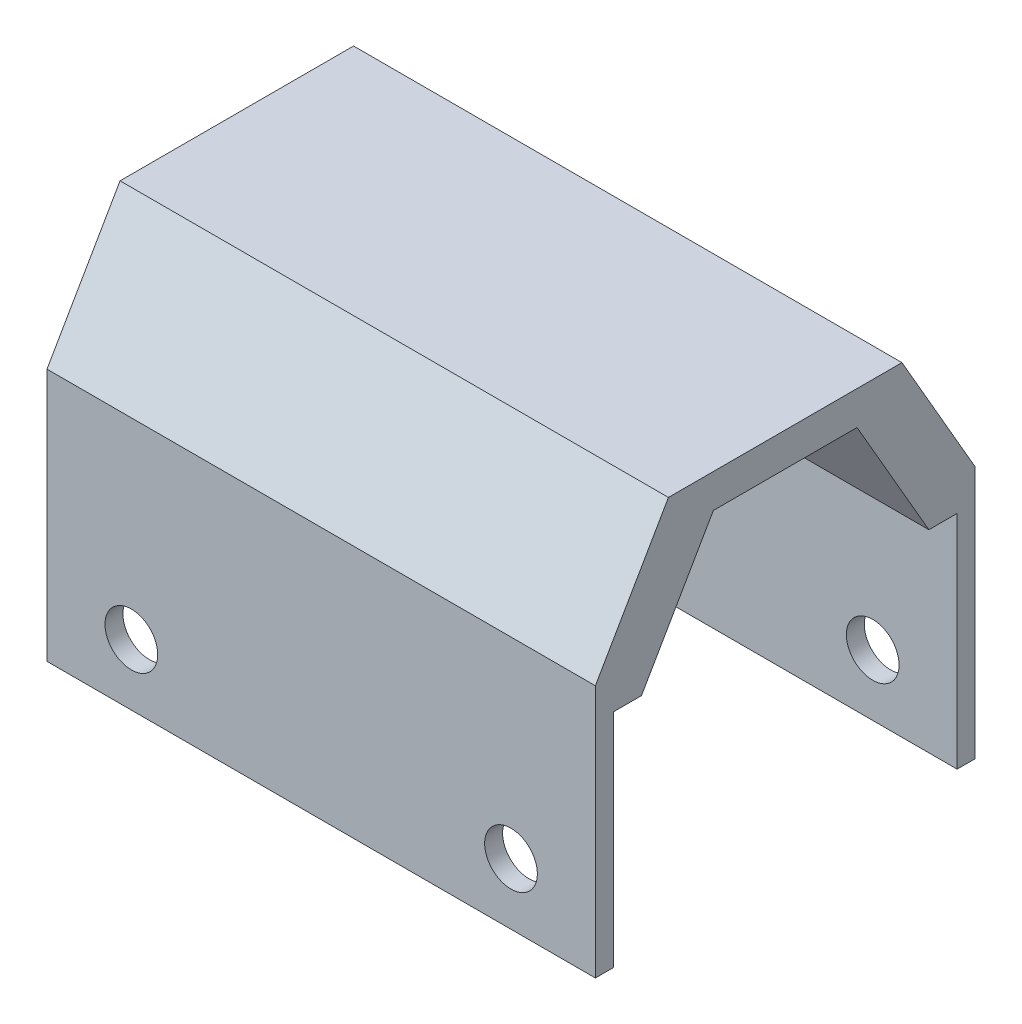
from build123d import *
from OCP.BRepFilletAPI import BRepFilletAPI_MakeChamfer

# Parameters (mm, degrees)
ESBO_O1_W                = 26
ESBO_O1_H                = 18
RESSALTO_EXTRUS_O1_DEPTH = 18
CORTE_EXTRUS_O1_DEPTH    = 33.878564446
ESBO_O3_R                = 1.25
CORTE_EXTRUS_O2_DEPTH    = 24.958297101
CHANFRO1_SIZE            = 6
CHANFRO1_SIZE2           = 3.464101615


with BuildPart() as part:
    # Esboço1 → Ressalto-extrusão1 (new body)
    with BuildSketch(Plane.XY):
        Rectangle(ESBO_O1_W, ESBO_O1_H)
    extrude(amount=RESSALTO_EXTRUS_O1_DEPTH)

    # Esboço2 → Corte-extrusão1 (cut, through all)
    with BuildSketch(Plane(origin=(13, 0, 0), x_dir=(0, 0, -1), z_dir=(1, 0, 0))):
        Polygon((-17.15, -9), (-0.85, -9), (-0.85, 1.5), (-2.187266824, 1.5), (-5.593633412, 7.4), (-12.406366588, 7.4), (-15.812733176, 1.5), (-17.15, 1.5), align=None)
    extrude(amount=-CORTE_EXTRUS_O1_DEPTH, mode=Mode.SUBTRACT)

    # Esboço3 → Corte-extrusão2 (cut, through all)
    with BuildSketch(Plane.XY.offset(18)):
        with Locations((-9, -6.1)):
            Circle(ESBO_O3_R)
        with Locations((9, -6.1)):
            Circle(ESBO_O3_R)
    extrude(amount=-CORTE_EXTRUS_O2_DEPTH, mode=Mode.SUBTRACT)

    # Chanfro1: one chamfer whose edges measure the first distance from different faces: ONE call of the kernel's chamfer builder (chamfer() names one face for all edges)
    chanfro1_edges_1 = [part.edges().sort_by_distance(p)[0] for p in [
        (0, 9, 0),
    ]]
    chanfro1_side_1 = [part.faces().sort_by_distance(p)[0] for p in [
        (0, 0.130704702, 0),
    ]]
    chanfro1_edges_2 = [part.edges().sort_by_distance(p)[0] for p in [
        (0, 9, 18),
    ]]
    chanfro1_side_2 = [part.faces().sort_by_distance(p)[0] for p in [
        (0, 0.130704702, 18),
    ]]
    chanfro1 = BRepFilletAPI_MakeChamfer(part.part.solid().wrapped)
    for e in chanfro1_edges_1:
        chanfro1.Add(CHANFRO1_SIZE, CHANFRO1_SIZE2, e.wrapped, chanfro1_side_1[0].wrapped)  # the first distance lies on this face
    for e in chanfro1_edges_2:
        chanfro1.Add(CHANFRO1_SIZE, CHANFRO1_SIZE2, e.wrapped, chanfro1_side_2[0].wrapped)  # the first distance lies on this face
    add(Compound.cast(chanfro1.Shape()), mode=Mode.REPLACE)


solid = part.part
